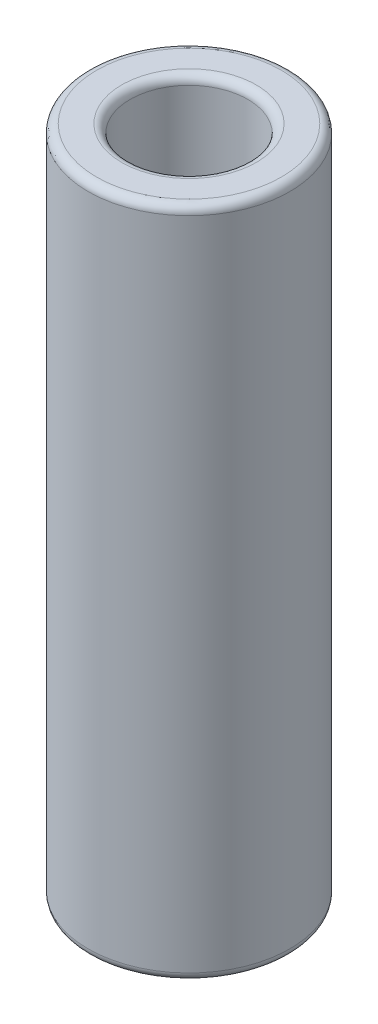
from build123d import *

# Parameters (mm, degrees)
SZKIC3_R                    = 6
SZKIC3_R_2                  = 3.5
DODANIE_WYCI_GNI_CIE1_DEPTH = 40
ZAOKR_GLENIE1_R             = 0.5
ZAOKR_GLENIE2_R             = 0.5


with BuildPart() as part:
    # Szkic3 → Dodanie-wyciągnięcie1 (new body)
    with BuildSketch(Plane(origin=(0, 0, 0), x_dir=(1, 0, 0), z_dir=(0, 1, 0))):
        with Locations(Location((0, 0, 0), (0, 0, 270))):
            Circle(SZKIC3_R)
        with Locations(Location((0, 0, 0), (0, 0, 270))):
            Circle(SZKIC3_R_2, mode=Mode.SUBTRACT)
    extrude(amount=DODANIE_WYCI_GNI_CIE1_DEPTH)

    # Zaokrąglenie1
    zaokr_glenie1_edges = [part.edges().sort_by_distance(p)[0] for p in [
        (0, 40, -6),
        (0, 40, -3.5),
    ]]
    fillet(zaokr_glenie1_edges, radius=ZAOKR_GLENIE1_R)

    # Zaokrąglenie2
    zaokr_glenie2_edges = [part.edges().sort_by_distance(p)[0] for p in [
        (0, 0, -6),
        (0, 0, -3.5),
    ]]
    fillet(zaokr_glenie2_edges, radius=ZAOKR_GLENIE2_R)


solid = part.part
